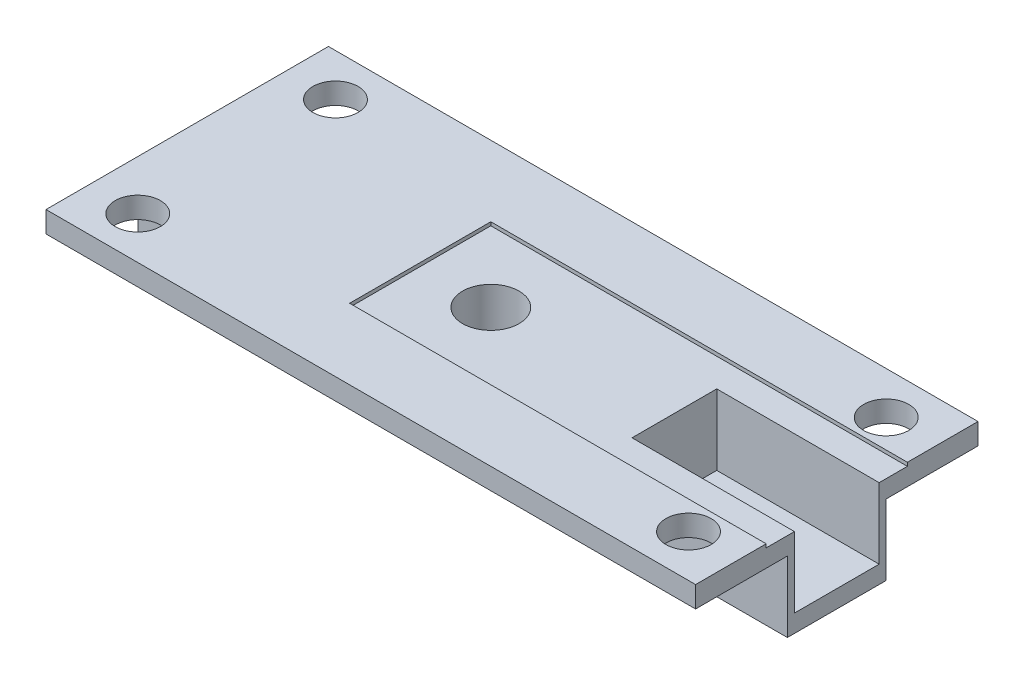
from build123d import *

# Parameters (mm, degrees)
SKETCH_1_W          = 46
SKETCH_1_H          = 20
SKETCH_1_R          = 1.6
EXTRUDE_1_DEPTH     = 6.5
SKETCH_2_W          = 29.5
SKETCH_2_H          = 10
CUT_EXTRUDE_1_DEPTH = 0.25
SKETCH_3_R          = 2
CUT_EXTRUDE_2_DEPTH = 5.3
SKETCH_4_R          = 1.35
CUT_EXTRUDE_3_DEPTH = 1
SKETCH_5_W          = 11.5
SKETCH_5_H          = 6
CUT_EXTRUDE_4_DEPTH = 5
SKETCH_7_W          = 6.5
SKETCH_7_H          = 5
CUT_EXTRUDE_5_DEPTH = 48.521047968


with BuildPart() as part:
    # 草图1 → 凸台-拉伸1 (new body)
    with BuildSketch(Plane(origin=(0, 0, 0), x_dir=(1, 0, 0), z_dir=(0, 1, 0))):
        Rectangle(SKETCH_1_W, SKETCH_1_H)
        with Locations(Location((-19.5, 7, 0), (0, 0, 90))):
            Circle(SKETCH_1_R, mode=Mode.SUBTRACT)
        with Locations(Location((19.5, 7, 0), (0, 0, 90))):
            Circle(SKETCH_1_R, mode=Mode.SUBTRACT)
        with Locations(Location((-19.5, -7, 0), (0, 0, 90))):
            Circle(SKETCH_1_R, mode=Mode.SUBTRACT)
        with Locations(Location((19.5, -7, 0), (0, 0, 90))):
            Circle(SKETCH_1_R, mode=Mode.SUBTRACT)
    extrude(amount=EXTRUDE_1_DEPTH)

    # 草图2 → 切除-拉伸1 (cut)
    with BuildSketch(Plane(origin=(0, 6.5, 0), x_dir=(1, 0, 0), z_dir=(0, 1, 0))):
        with Locations((8.25, 0)):
            Rectangle(SKETCH_2_W, SKETCH_2_H)
    extrude(amount=-CUT_EXTRUDE_1_DEPTH, mode=Mode.SUBTRACT)

    # 草图3 → 切除-拉伸2 (cut)
    with BuildSketch(Plane(origin=(0, 6.25, 0), x_dir=(1, 0, 0), z_dir=(0, 1, 0))):
        with Locations(Location((-1.5, 0, 0), (0, 0, 270))):
            Circle(SKETCH_3_R)
    extrude(amount=-CUT_EXTRUDE_2_DEPTH, mode=Mode.SUBTRACT)

    # 草图4 → 切除-拉伸3 (cut)
    with BuildSketch(Plane(origin=(0, 0.95, 0), x_dir=(1, 0, 0), z_dir=(0, 1, 0))):
        with Locations(Location((-1.5, 0, 0), (0, 0, 270))):
            Circle(SKETCH_4_R)
    extrude(amount=-CUT_EXTRUDE_3_DEPTH, mode=Mode.SUBTRACT)

    # 草图5 → 切除-拉伸4 (cut)
    with BuildSketch(Plane(origin=(0, 6.25, 0), x_dir=(1, 0, 0), z_dir=(0, 1, 0))):
        with Locations((17.25, 0)):
            Rectangle(SKETCH_5_W, SKETCH_5_H)
    extrude(amount=-CUT_EXTRUDE_4_DEPTH, mode=Mode.SUBTRACT)

    # 草图7 → 切除-拉伸5 (cut, through all)
    with BuildSketch(Plane(origin=(23, 0, 0), x_dir=(0, 0, -1), z_dir=(1, 0, 0))):
        with Locations((-6.75, 2.5)):
            Rectangle(SKETCH_7_W, SKETCH_7_H)
        with Locations((6.75, 2.5)):
            Rectangle(SKETCH_7_W, SKETCH_7_H)
    extrude(amount=-CUT_EXTRUDE_5_DEPTH, mode=Mode.SUBTRACT)


solid = part.part
